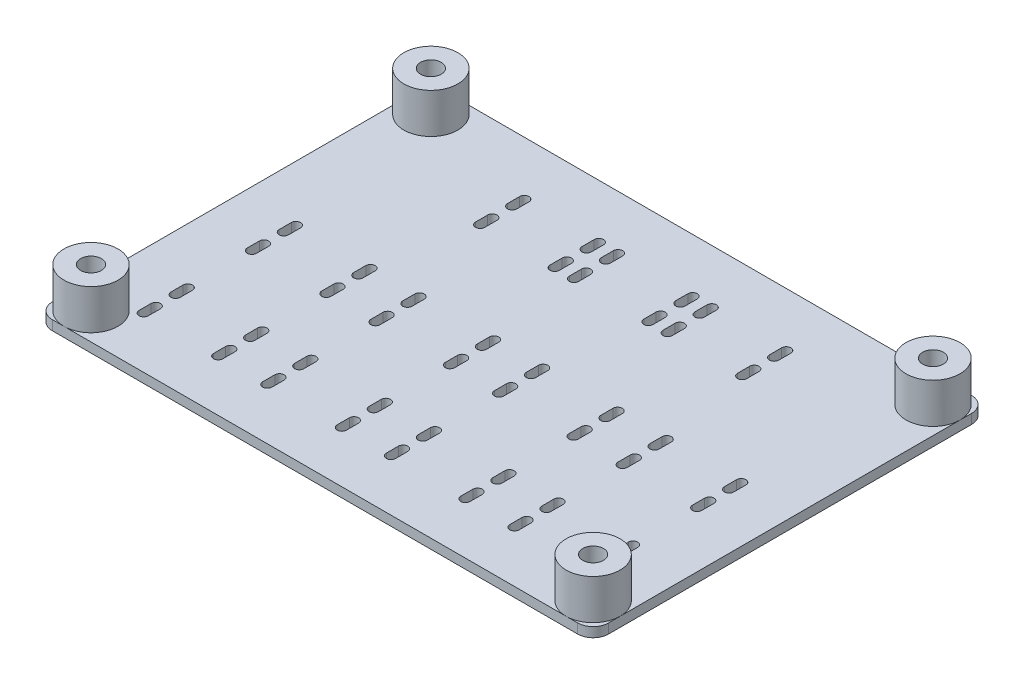
from build123d import *

# Parameters (mm, degrees)
SKETCH1_W           = 91.44
SKETCH1_H           = 64.77
BOSS_EXTRUDE1_DEPTH = 1.5875
SKETCH2_R           = 4.445
BOSS_EXTRUDE2_DEPTH = 6.5786
SKETCH3_R           = 1.6999966
CUT_EXTRUDE1_DEPTH  = 57.619712241
FILLET2_R           = 2.54


with BuildPart() as part:
    # Sketch1 → Boss-Extrude1 (new body)
    with BuildSketch(Plane(origin=(0, 0, 0), x_dir=(1, 0, 0), z_dir=(0, 1, 0))):
        Rectangle(SKETCH1_W, SKETCH1_H)
        with BuildLine():
            Line((-35.843, 1.085), (-35.843, -0.915))
            ThreePointArc((-35.843, -0.915), (-36.605, -1.677), (-37.367, -0.915))
            Line((-37.367, -0.915), (-37.367, 1.085))
            ThreePointArc((-37.367, 1.085), (-36.605, 1.847), (-35.843, 1.085))
        make_face(mode=Mode.SUBTRACT)
        with BuildLine():
            Line((-23.593, 1.085), (-23.593, -0.915))
            ThreePointArc((-23.593, -0.915), (-24.355, -1.677), (-25.117, -0.915))
            Line((-25.117, -0.915), (-25.117, 1.085))
            ThreePointArc((-25.117, 1.085), (-24.355, 1.847), (-23.593, 1.085))
        make_face(mode=Mode.SUBTRACT)
        with BuildLine():
            Line((-35.843, -4.165), (-35.843, -6.165))
            ThreePointArc((-35.843, -6.165), (-36.605, -6.927), (-37.367, -6.165))
            Line((-37.367, -6.165), (-37.367, -4.165))
            ThreePointArc((-37.367, -4.165), (-36.605, -3.403), (-35.843, -4.165))
        make_face(mode=Mode.SUBTRACT)
        with BuildLine():
            Line((-23.593, -4.165), (-23.593, -6.165))
            ThreePointArc((-23.593, -6.165), (-24.355, -6.927), (-25.117, -6.165))
            Line((-25.117, -6.165), (-25.117, -4.165))
            ThreePointArc((-25.117, -4.165), (-24.355, -3.403), (-23.593, -4.165))
        make_face(mode=Mode.SUBTRACT)
        with BuildLine():
            Line((-15.523, 1.085), (-15.523, -0.915))
            ThreePointArc((-15.523, -0.915), (-16.285, -1.677), (-17.047, -0.915))
            Line((-17.047, -0.915), (-17.047, 1.085))
            ThreePointArc((-17.047, 1.085), (-16.285, 1.847), (-15.523, 1.085))
        make_face(mode=Mode.SUBTRACT)
        with BuildLine():
            Line((-3.273, 1.085), (-3.273, -0.915))
            ThreePointArc((-3.273, -0.915), (-4.035, -1.677), (-4.797, -0.915))
            Line((-4.797, -0.915), (-4.797, 1.085))
            ThreePointArc((-4.797, 1.085), (-4.035, 1.847), (-3.273, 1.085))
        make_face(mode=Mode.SUBTRACT)
        with BuildLine():
            Line((-15.523, -4.165), (-15.523, -6.165))
            ThreePointArc((-15.523, -6.165), (-16.285, -6.927), (-17.047, -6.165))
            Line((-17.047, -6.165), (-17.047, -4.165))
            ThreePointArc((-17.047, -4.165), (-16.285, -3.403), (-15.523, -4.165))
        make_face(mode=Mode.SUBTRACT)
        with BuildLine():
            Line((-3.273, -4.165), (-3.273, -6.165))
            ThreePointArc((-3.273, -6.165), (-4.035, -6.927), (-4.797, -6.165))
            Line((-4.797, -6.165), (-4.797, -4.165))
            ThreePointArc((-4.797, -4.165), (-4.035, -3.403), (-3.273, -4.165))
        make_face(mode=Mode.SUBTRACT)
        with BuildLine():
            Line((4.797, 1.085), (4.797, -0.915))
            ThreePointArc((4.797, -0.915), (4.035, -1.677), (3.273, -0.915))
            Line((3.273, -0.915), (3.273, 1.085))
            ThreePointArc((3.273, 1.085), (4.035, 1.847), (4.797, 1.085))
        make_face(mode=Mode.SUBTRACT)
        with BuildLine():
            Line((17.047, 1.085), (17.047, -0.915))
            ThreePointArc((17.047, -0.915), (16.285, -1.677), (15.523, -0.915))
            Line((15.523, -0.915), (15.523, 1.085))
            ThreePointArc((15.523, 1.085), (16.285, 1.847), (17.047, 1.085))
        make_face(mode=Mode.SUBTRACT)
        with BuildLine():
            Line((4.797, -4.165), (4.797, -6.165))
            ThreePointArc((4.797, -6.165), (4.035, -6.927), (3.273, -6.165))
            Line((3.273, -6.165), (3.273, -4.165))
            ThreePointArc((3.273, -4.165), (4.035, -3.403), (4.797, -4.165))
        make_face(mode=Mode.SUBTRACT)
        with BuildLine():
            Line((17.047, -4.165), (17.047, -6.165))
            ThreePointArc((17.047, -6.165), (16.285, -6.927), (15.523, -6.165))
            Line((15.523, -6.165), (15.523, -4.165))
            ThreePointArc((15.523, -4.165), (16.285, -3.403), (17.047, -4.165))
        make_face(mode=Mode.SUBTRACT)
        with BuildLine():
            Line((25.117, 1.085), (25.117, -0.915))
            ThreePointArc((25.117, -0.915), (24.355, -1.677), (23.593, -0.915))
            Line((23.593, -0.915), (23.593, 1.085))
            ThreePointArc((23.593, 1.085), (24.355, 1.847), (25.117, 1.085))
        make_face(mode=Mode.SUBTRACT)
        with BuildLine():
            Line((25.117, -4.165), (25.117, -6.165))
            ThreePointArc((25.117, -6.165), (24.355, -6.927), (23.593, -6.165))
            Line((23.593, -6.165), (23.593, -4.165))
            ThreePointArc((23.593, -4.165), (24.355, -3.403), (25.117, -4.165))
        make_face(mode=Mode.SUBTRACT)
        with BuildLine():
            Line((37.367, -4.165), (37.367, -6.165))
            ThreePointArc((37.367, -6.165), (36.605, -6.927), (35.843, -6.165))
            Line((35.843, -6.165), (35.843, -4.165))
            ThreePointArc((35.843, -4.165), (36.605, -3.403), (37.367, -4.165))
        make_face(mode=Mode.SUBTRACT)
        with BuildLine():
            Line((37.367, 1.085), (37.367, -0.915))
            ThreePointArc((37.367, -0.915), (36.605, -1.677), (35.843, -0.915))
            Line((35.843, -0.915), (35.843, 1.085))
            ThreePointArc((35.843, 1.085), (36.605, 1.847), (37.367, 1.085))
        make_face(mode=Mode.SUBTRACT)
        with BuildLine():
            Line((25.117, -18.695), (25.117, -16.695))
            ThreePointArc((25.117, -16.695), (24.355, -15.933), (23.593, -16.695))
            Line((23.593, -16.695), (23.593, -18.695))
            ThreePointArc((23.593, -18.695), (24.355, -19.457), (25.117, -18.695))
        make_face(mode=Mode.SUBTRACT)
        with BuildLine():
            Line((25.117, -23.945), (25.117, -21.945))
            ThreePointArc((25.117, -21.945), (24.355, -21.183), (23.593, -21.945))
            Line((23.593, -21.945), (23.593, -23.945))
            ThreePointArc((23.593, -23.945), (24.355, -24.707), (25.117, -23.945))
        make_face(mode=Mode.SUBTRACT)
        with BuildLine():
            Line((17.047, -23.945), (17.047, -21.945))
            ThreePointArc((17.047, -21.945), (16.285, -21.183), (15.523, -21.945))
            Line((15.523, -21.945), (15.523, -23.945))
            ThreePointArc((15.523, -23.945), (16.285, -24.707), (17.047, -23.945))
        make_face(mode=Mode.SUBTRACT)
        with BuildLine():
            Line((17.047, -18.695), (17.047, -16.695))
            ThreePointArc((17.047, -16.695), (16.285, -15.933), (15.523, -16.695))
            Line((15.523, -16.695), (15.523, -18.695))
            ThreePointArc((15.523, -18.695), (16.285, -19.457), (17.047, -18.695))
        make_face(mode=Mode.SUBTRACT)
        with BuildLine():
            Line((4.797, -23.945), (4.797, -21.945))
            ThreePointArc((4.797, -21.945), (4.035, -21.183), (3.273, -21.945))
            Line((3.273, -21.945), (3.273, -23.945))
            ThreePointArc((3.273, -23.945), (4.035, -24.707), (4.797, -23.945))
        make_face(mode=Mode.SUBTRACT)
        with BuildLine():
            Line((4.797, -18.695), (4.797, -16.695))
            ThreePointArc((4.797, -16.695), (4.035, -15.933), (3.273, -16.695))
            Line((3.273, -16.695), (3.273, -18.695))
            ThreePointArc((3.273, -18.695), (4.035, -19.457), (4.797, -18.695))
        make_face(mode=Mode.SUBTRACT)
        with BuildLine():
            Line((-3.273, -18.695), (-3.273, -16.695))
            ThreePointArc((-3.273, -16.695), (-4.035, -15.933), (-4.797, -16.695))
            Line((-4.797, -16.695), (-4.797, -18.695))
            ThreePointArc((-4.797, -18.695), (-4.035, -19.457), (-3.273, -18.695))
        make_face(mode=Mode.SUBTRACT)
        with BuildLine():
            Line((-3.273, -23.945), (-3.273, -21.945))
            ThreePointArc((-3.273, -21.945), (-4.035, -21.183), (-4.797, -21.945))
            Line((-4.797, -21.945), (-4.797, -23.945))
            ThreePointArc((-4.797, -23.945), (-4.035, -24.707), (-3.273, -23.945))
        make_face(mode=Mode.SUBTRACT)
        with BuildLine():
            Line((-15.523, -23.945), (-15.523, -21.945))
            ThreePointArc((-15.523, -21.945), (-16.285, -21.183), (-17.047, -21.945))
            Line((-17.047, -21.945), (-17.047, -23.945))
            ThreePointArc((-17.047, -23.945), (-16.285, -24.707), (-15.523, -23.945))
        make_face(mode=Mode.SUBTRACT)
        with BuildLine():
            Line((-15.523, -18.695), (-15.523, -16.695))
            ThreePointArc((-15.523, -16.695), (-16.285, -15.933), (-17.047, -16.695))
            Line((-17.047, -16.695), (-17.047, -18.695))
            ThreePointArc((-17.047, -18.695), (-16.285, -19.457), (-15.523, -18.695))
        make_face(mode=Mode.SUBTRACT)
        with BuildLine():
            Line((-23.593, -23.945), (-23.593, -21.945))
            ThreePointArc((-23.593, -21.945), (-24.355, -21.183), (-25.117, -21.945))
            Line((-25.117, -21.945), (-25.117, -23.945))
            ThreePointArc((-25.117, -23.945), (-24.355, -24.707), (-23.593, -23.945))
        make_face(mode=Mode.SUBTRACT)
        with BuildLine():
            Line((-23.593, -18.695), (-23.593, -16.695))
            ThreePointArc((-23.593, -16.695), (-24.355, -15.933), (-25.117, -16.695))
            Line((-25.117, -16.695), (-25.117, -18.695))
            ThreePointArc((-25.117, -18.695), (-24.355, -19.457), (-23.593, -18.695))
        make_face(mode=Mode.SUBTRACT)
        with BuildLine():
            Line((-35.843, -18.695), (-35.843, -16.695))
            ThreePointArc((-35.843, -16.695), (-36.605, -15.933), (-37.367, -16.695))
            Line((-37.367, -16.695), (-37.367, -18.695))
            ThreePointArc((-37.367, -18.695), (-36.605, -19.457), (-35.843, -18.695))
        make_face(mode=Mode.SUBTRACT)
        with BuildLine():
            Line((-35.843, -23.945), (-35.843, -21.945))
            ThreePointArc((-35.843, -21.945), (-36.605, -21.183), (-37.367, -21.945))
            Line((-37.367, -21.945), (-37.367, -23.945))
            ThreePointArc((-37.367, -23.945), (-36.605, -24.707), (-35.843, -23.945))
        make_face(mode=Mode.SUBTRACT)
        with BuildLine():
            Line((37.367, -23.945), (37.367, -21.945))
            ThreePointArc((37.367, -21.945), (36.605, -21.183), (35.843, -21.945))
            Line((35.843, -21.945), (35.843, -23.945))
            ThreePointArc((35.843, -23.945), (36.605, -24.707), (37.367, -23.945))
        make_face(mode=Mode.SUBTRACT)
        with BuildLine():
            Line((37.367, -18.695), (37.367, -16.695))
            ThreePointArc((37.367, -16.695), (36.605, -15.933), (35.843, -16.695))
            Line((35.843, -16.695), (35.843, -18.695))
            ThreePointArc((35.843, -18.695), (36.605, -19.457), (37.367, -18.695))
        make_face(mode=Mode.SUBTRACT)
        with BuildLine():
            Line((-22.2970022, 21.55638), (-22.2970022, 23.55638))
            ThreePointArc((-22.2970022, 23.55638), (-21.5350022, 24.31838), (-20.7730022, 23.55638))
            Line((-20.7730022, 23.55638), (-20.7730022, 21.55638))
            ThreePointArc((-20.7730022, 21.55638), (-21.5350022, 20.79438), (-22.2970022, 21.55638))
        make_face(mode=Mode.SUBTRACT)
        with BuildLine():
            Line((8.5230022, 21.55638), (8.5230022, 23.55638))
            ThreePointArc((8.5230022, 23.55638), (9.2850022, 24.31838), (10.0470022, 23.55638))
            Line((10.0470022, 23.55638), (10.0470022, 21.55638))
            ThreePointArc((10.0470022, 21.55638), (9.2850022, 20.79438), (8.5230022, 21.55638))
        make_face(mode=Mode.SUBTRACT)
        with BuildLine():
            Line((5.363, 21.55638), (5.363, 23.55638))
            ThreePointArc((5.363, 23.55638), (6.125, 24.31838), (6.887, 23.55638))
            Line((6.887, 23.55638), (6.887, 21.55638))
            ThreePointArc((6.887, 21.55638), (6.125, 20.79438), (5.363, 21.55638))
        make_face(mode=Mode.SUBTRACT)
        with BuildLine():
            Line((-10.0470022, 21.55638), (-10.0470022, 23.55638))
            ThreePointArc((-10.0470022, 23.55638), (-9.2850022, 24.31838), (-8.5230022, 23.55638))
            Line((-8.5230022, 23.55638), (-8.5230022, 21.55638))
            ThreePointArc((-8.5230022, 21.55638), (-9.2850022, 20.79438), (-10.0470022, 21.55638))
        make_face(mode=Mode.SUBTRACT)
        with BuildLine():
            Line((-6.887, 21.55638), (-6.887, 23.55638))
            ThreePointArc((-6.887, 23.55638), (-6.125, 24.31838), (-5.363, 23.55638))
            Line((-5.363, 23.55638), (-5.363, 21.55638))
            ThreePointArc((-5.363, 21.55638), (-6.125, 20.79438), (-6.887, 21.55638))
        make_face(mode=Mode.SUBTRACT)
        with BuildLine():
            Line((20.7730022, 21.55638), (20.7730022, 23.55638))
            ThreePointArc((20.7730022, 23.55638), (21.5350022, 24.31838), (22.2970022, 23.55638))
            Line((22.2970022, 23.55638), (22.2970022, 21.55638))
            ThreePointArc((22.2970022, 21.55638), (21.5350022, 20.79438), (20.7730022, 21.55638))
        make_face(mode=Mode.SUBTRACT)
        with BuildLine():
            Line((20.7730022, 18.30638), (20.7730022, 16.30638))
            ThreePointArc((20.7730022, 16.30638), (21.5350022, 15.54438), (22.2970022, 16.30638))
            Line((22.2970022, 16.30638), (22.2970022, 18.30638))
            ThreePointArc((22.2970022, 18.30638), (21.5350022, 19.06838), (20.7730022, 18.30638))
        make_face(mode=Mode.SUBTRACT)
        with BuildLine():
            Line((8.5230022, 18.30638), (8.5230022, 16.30638))
            ThreePointArc((8.5230022, 16.30638), (9.2850022, 15.54438), (10.0470022, 16.30638))
            Line((10.0470022, 16.30638), (10.0470022, 18.30638))
            ThreePointArc((10.0470022, 18.30638), (9.2850022, 19.06838), (8.5230022, 18.30638))
        make_face(mode=Mode.SUBTRACT)
        with BuildLine():
            Line((5.363, 18.30638), (5.363, 16.30638))
            ThreePointArc((5.363, 16.30638), (6.125, 15.54438), (6.887, 16.30638))
            Line((6.887, 16.30638), (6.887, 18.30638))
            ThreePointArc((6.887, 18.30638), (6.125, 19.06838), (5.363, 18.30638))
        make_face(mode=Mode.SUBTRACT)
        with BuildLine():
            Line((-6.887, 18.30638), (-6.887, 16.30638))
            ThreePointArc((-6.887, 16.30638), (-6.125, 15.54438), (-5.363, 16.30638))
            Line((-5.363, 16.30638), (-5.363, 18.30638))
            ThreePointArc((-5.363, 18.30638), (-6.125, 19.06838), (-6.887, 18.30638))
        make_face(mode=Mode.SUBTRACT)
        with BuildLine():
            Line((-10.0470022, 18.30638), (-10.0470022, 16.30638))
            ThreePointArc((-10.0470022, 16.30638), (-9.2850022, 15.54438), (-8.5230022, 16.30638))
            Line((-8.5230022, 16.30638), (-8.5230022, 18.30638))
            ThreePointArc((-8.5230022, 18.30638), (-9.2850022, 19.06838), (-10.0470022, 18.30638))
        make_face(mode=Mode.SUBTRACT)
        with BuildLine():
            Line((-22.2970022, 18.30638), (-22.2970022, 16.30638))
            ThreePointArc((-22.2970022, 16.30638), (-21.5350022, 15.54438), (-20.7730022, 16.30638))
            Line((-20.7730022, 16.30638), (-20.7730022, 18.30638))
            ThreePointArc((-20.7730022, 18.30638), (-21.5350022, 19.06838), (-22.2970022, 18.30638))
        make_face(mode=Mode.SUBTRACT)
    extrude(amount=BOSS_EXTRUDE1_DEPTH)

    # Sketch2 → Boss-Extrude2 (add)
    with BuildSketch(Plane(origin=(0, 1.5875, 0), x_dir=(1, 0, 0), z_dir=(0, 1, 0))):
        with Locations(Location((-41.275, 27.94, 0), (0, 0, 90))):
            Circle(SKETCH2_R)
        with Locations(Location((41.275, 27.94, 0), (0, 0, 90))):
            Circle(SKETCH2_R)
        with Locations(Location((41.275, -27.94, 0), (0, 0, 270))):
            Circle(SKETCH2_R)
        with Locations(Location((-41.275, -27.94, 0), (0, 0, 90))):
            Circle(SKETCH2_R)
    extrude(amount=BOSS_EXTRUDE2_DEPTH)

    # Sketch3 → Cut-Extrude1 (cut, through all)
    with BuildSketch(Plane(origin=(0, 8.1661, 0), x_dir=(1, 0, 0), z_dir=(0, 1, 0))):
        with Locations(Location((-41.275, 27.94, 0), (0, 0, 270))):
            Circle(SKETCH3_R)
        with Locations(Location((41.275, 27.94, 0), (0, 0, 270))):
            Circle(SKETCH3_R)
        with Locations(Location((41.275, -27.94, 0), (0, 0, 270))):
            Circle(SKETCH3_R)
        with Locations(Location((-41.275, -27.94, 0), (0, 0, 270))):
            Circle(SKETCH3_R)
    extrude(amount=-CUT_EXTRUDE1_DEPTH, mode=Mode.SUBTRACT)

    # Fillet2
    fillet2_edges = [part.edges().sort_by_distance(p)[0] for p in [
        (45.72, 0.79375, 32.385),
        (-45.72, 0.79375, 32.385),
        (-45.72, 0.79375, -32.385),
        (45.72, 0.79375, -32.385),
    ]]
    fillet(fillet2_edges, radius=FILLET2_R)


solid = part.part
